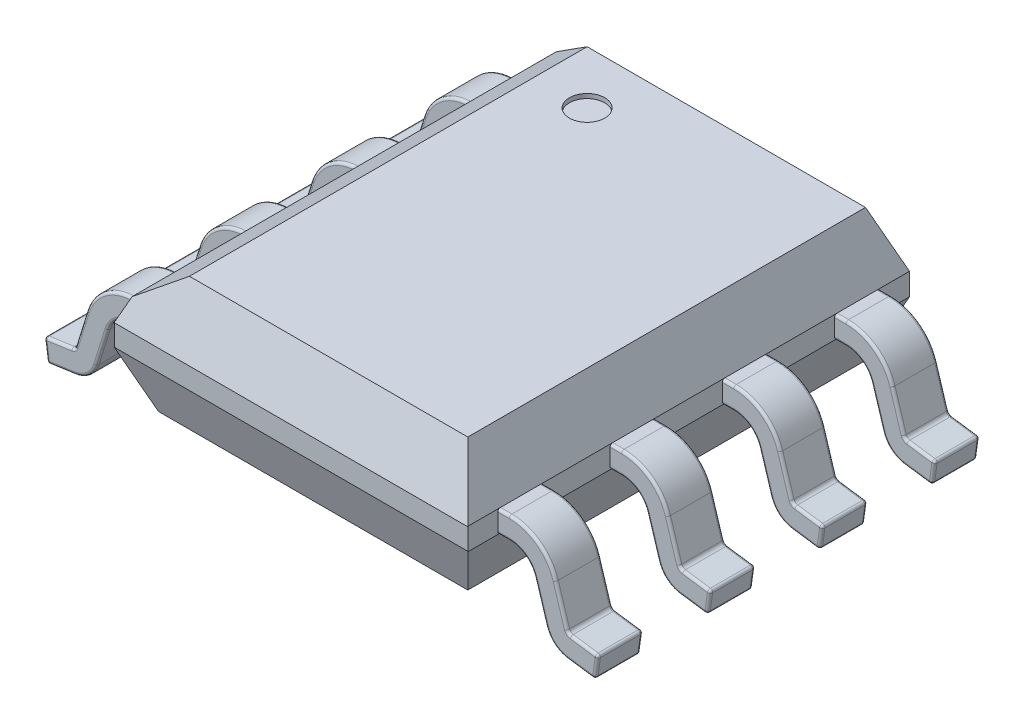
from build123d import *
from OCP.BRepFilletAPI import BRepFilletAPI_MakeChamfer

# Parameters (mm, degrees)
EXTRUDE_1_DEPTH        = 2.5
EXTRUDE_1_DEPTH_BACK   = 2.5
EXTRUDE_2_DEPTH        = 0.255
EXTRUDE_2_DEPTH_BACK   = 0.255
EXTRUDE_2_START        = 1.905
FILLET_1_R             = 0.03
PATTERN_LINEAR_1_COUNT = 4
PATTERN_LINEAR_1_PITCH = 1.27
CHAMFER_1_SIZE         = 0.25
CHAMFER_1_SIZE2        = 0.63
CHAMFER_2_SIZE         = 0.63
CHAMFER_2_SIZE2        = 0.25
SKETCH_2_R             = 0.2
CUT_EXTRUDE_1_DEPTH    = 0.05


with BuildPart() as part:
    # Эскиз1 → Бобышка-Вытянуть1 (new, two sides: drawn at the far end of the back side and taken through both)
    with BuildSketch(Plane.XY.offset(-EXTRUDE_1_DEPTH_BACK)):
        Polygon((-2, 0.875), (-1.75, 0.25), (1.75, 0.25), (2, 0.875), (2, 1.125), (1.75, 1.75), (-1.4, 1.75), (-1.9, 1.375), (-2, 1.125), align=None)
    extrude(amount=EXTRUDE_1_DEPTH + EXTRUDE_1_DEPTH_BACK)

    # Фаска1: one chamfer whose edges measure the first distance from different faces: ONE call of the kernel's chamfer builder (chamfer() names one face for all edges)
    chamfer_1_edges_1 = [part.edges().sort_by_distance(p)[0] for p in [
        (0, 0.25, 2.5),
    ]]
    chamfer_1_side_1 = [part.faces().sort_by_distance(p)[0] for p in [
        (0, 0.25, 0),
    ]]
    chamfer_1_edges_2 = [part.edges().sort_by_distance(p)[0] for p in [
        (0.175, 1.75, 2.5),
    ]]
    chamfer_1_side_2 = [part.faces().sort_by_distance(p)[0] for p in [
        (0.175, 1.75, 0),
    ]]
    chamfer_1 = BRepFilletAPI_MakeChamfer(part.part.solid().wrapped)
    for e in chamfer_1_edges_1:
        chamfer_1.Add(CHAMFER_1_SIZE, CHAMFER_1_SIZE2, e.wrapped, chamfer_1_side_1[0].wrapped)  # the first distance lies on this face
    for e in chamfer_1_edges_2:
        chamfer_1.Add(CHAMFER_1_SIZE, CHAMFER_1_SIZE2, e.wrapped, chamfer_1_side_2[0].wrapped)  # the first distance lies on this face
    add(Compound.cast(chamfer_1.Shape()), mode=Mode.REPLACE)

    # Фаска2
    chamfer_2_edges = [part.edges().sort_by_distance(p)[0] for p in [
        (0, 0.25, -2.5),
        (0.175, 1.75, -2.5),
    ]]
    chamfer_2_side = [part.faces().sort_by_distance(p)[0] for p in [
        (0.019649805, 0.99270428, -2.5),
    ]]
    chamfer(chamfer_2_edges, length=CHAMFER_2_SIZE, length2=CHAMFER_2_SIZE2, reference=chamfer_2_side[0])

    # Эскиз2 → Вырез-Вытянуть1 (cut)
    with BuildSketch(Plane(origin=(0, 1.75, 0), x_dir=(1, 0, 0), z_dir=(0, 1, 0))):
        with Locations((-0.8, 1.65)):
            Circle(SKETCH_2_R)
    extrude(amount=-CUT_EXTRUDE_1_DEPTH, mode=Mode.SUBTRACT)


with BuildPart() as body_2:
    # Эскиз1<3> → Бобышка-Вытянуть2 (new, two sides: drawn at the far end of the back side and taken through both)
    with BuildSketch(Plane.XY.offset(EXTRUDE_2_START - EXTRUDE_2_DEPTH_BACK)):
        with BuildLine():
            Line((-2.129055642, 0.875), (-2, 0.875))
            Line((-2, 0.875), (-2, 1.125))
            Line((-2, 1.125), (-2.129055642, 1.125))
            ThreePointArc((-2.129055642, 1.125), (-2.455211514, 1.017857028), (-2.654293533, 0.738172171))
            Line((-2.654293533, 0.738172171), (-2.782324759, 0.326050111))
            ThreePointArc((-2.782324759, 0.326050111), (-2.797686975, 0.302790603), (-2.823115003, 0.291370542))
            Line((-2.823115003, 0.291370542), (-3.134793275, 0.247567017))
            Line((-3.134793275, 0.247567017), (-3.1, 0))
            Line((-3.1, 0), (-2.788321728, 0.043803524))
            ThreePointArc((-2.788321728, 0.043803524), (-2.635753558, 0.112323891), (-2.543580263, 0.251880943))
            Line((-2.543580263, 0.251880943), (-2.415549037, 0.664003002))
            ThreePointArc((-2.415549037, 0.664003002), (-2.306958845, 0.816558379), (-2.129055642, 0.875))
        make_face()
    extrude(amount=EXTRUDE_2_DEPTH + EXTRUDE_2_DEPTH_BACK)

    # Скругление1
    fillet_1_edges = [body_2.edges().sort_by_distance(p)[0] for p in [
        (-2.064527821, 0.875, 1.65),
        (-2.306958845, 0.816558379, 1.65),
        (-2.47956465, 0.457941973, 1.65),
        (-2.635753558, 0.112323891, 1.65),
        (-2.064527821, 0.875, 2.16),
        (-2.306958845, 0.816558379, 2.16),
        (-2.47956465, 0.457941973, 2.16),
        (-2.635753558, 0.112323891, 2.16),
        (-2.718309146, 0.532111141, 1.65),
        (-2.064527821, 1.125, 1.65),
        (-2.718309146, 0.532111141, 2.16),
        (-2.064527821, 1.125, 2.16),
        (-3.117396638, 0.123783509, 1.65),
        (-3.1, 0, 1.905),
        (-3.117396638, 0.123783509, 2.16),
        (-3.134793275, 0.247567017, 1.905),
        (-2.944160864, 0.021901762, 1.65),
        (-2.978954139, 0.269468779, 1.65),
        (-2.978954139, 0.269468779, 2.16),
        (-2.944160864, 0.021901762, 2.16),
        (-2.797686975, 0.302790603, 1.65),
        (-2.455211514, 1.017857028, 1.65),
        (-2.797686975, 0.302790603, 2.16),
        (-2.455211514, 1.017857028, 2.16),
    ]]
    fillet(fillet_1_edges, radius=FILLET_1_R)


with BuildPart() as pattern_linear_1_1:
    # Линейный массив1: pattern copy
    add(body_2.part.moved(Location(Vector(0, 0, -1) * (1 * PATTERN_LINEAR_1_PITCH))))


with BuildPart() as pattern_linear_1_2:
    # Линейный массив1: pattern copy
    add(body_2.part.moved(Location(Vector(0, 0, -1) * (2 * PATTERN_LINEAR_1_PITCH))))


with BuildPart() as pattern_linear_1_3:
    # Линейный массив1: pattern copy
    add(body_2.part.moved(Location(Vector(0, 0, -1) * (3 * PATTERN_LINEAR_1_PITCH))))


with BuildPart() as body_6:
    # Зеркальное отражение1: mirrored copy
    add(body_2.part.mirror(Plane(origin=(0, 0, 0), x_dir=(0, 0, 1), z_dir=(1, 0, 0))))


with BuildPart() as body_7:
    # Mirror 1 2: mirrored copy
    add(pattern_linear_1_1.part.mirror(Plane(origin=(0, 0, 0), x_dir=(0, 0, 1), z_dir=(1, 0, 0))))


with BuildPart() as body_8:
    # Mirror 1 3: mirrored copy
    add(pattern_linear_1_2.part.mirror(Plane(origin=(0, 0, 0), x_dir=(0, 0, 1), z_dir=(1, 0, 0))))


with BuildPart() as body_9:
    # Mirror 1 4: mirrored copy
    add(pattern_linear_1_3.part.mirror(Plane(origin=(0, 0, 0), x_dir=(0, 0, 1), z_dir=(1, 0, 0))))


solid = Compound([part.part, body_2.part, pattern_linear_1_1.part, pattern_linear_1_2.part, pattern_linear_1_3.part, body_6.part, body_7.part, body_8.part, body_9.part])
